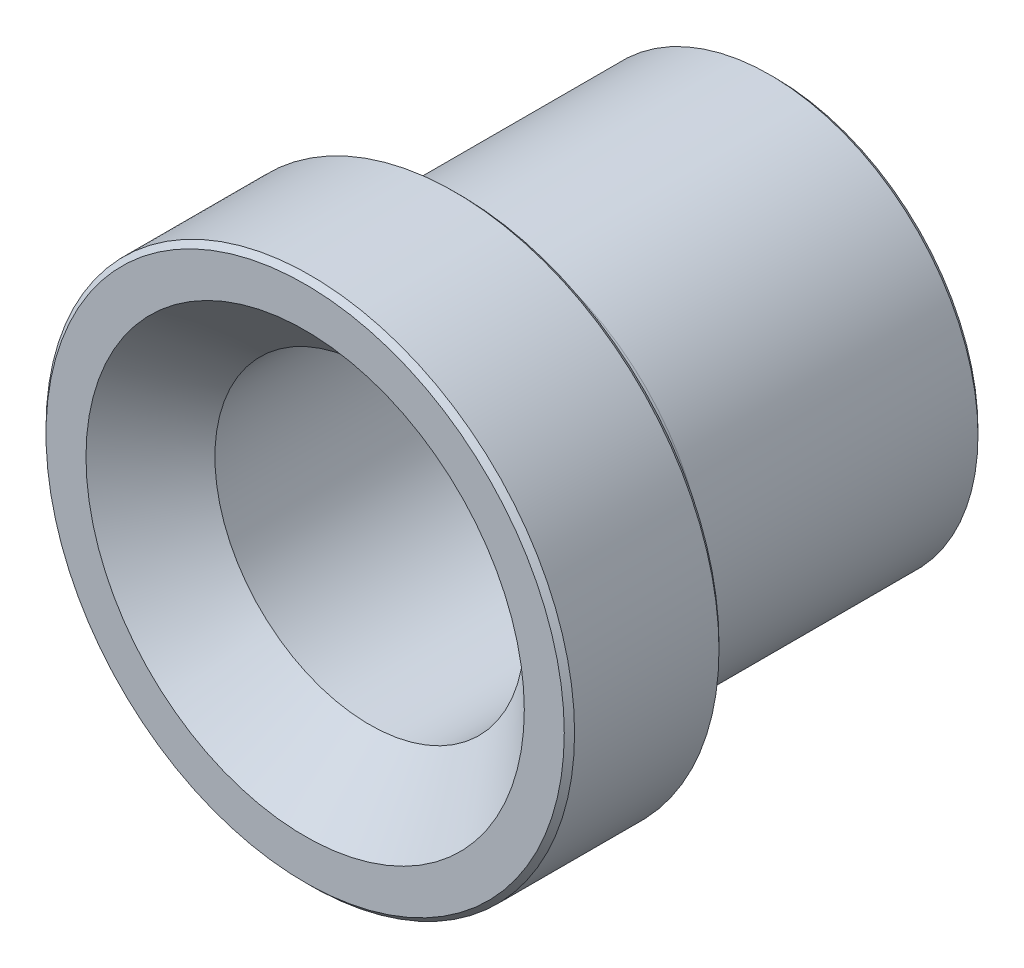
from build123d import *

# Parameters (mm, degrees)
CROQUIS2_W            = 5
CROQUIS2_H            = 5
CORTAR_EXTRUIR1_DEPTH = 24.290725622


with BuildPart() as part:
    # Croquis1 → Revolución1 (revolve)
    with BuildSketch(Plane(origin=(0, 0, 0), x_dir=(0, 0, -1), z_dir=(1, 0, 0)), mode=Mode.PRIVATE) as revoluci_n1_sk:
        with BuildLine():
            Line((0, 8.5), (0, 10.05))
            Line((0, 10.05), (0.2, 10.25))
            Line((0.2, 10.25), (5.8, 10.25))
            Line((5.8, 10.25), (6, 10.05))
            Line((6, 10.05), (6, 9.565))
            ThreePointArc((6, 9.565), (6.439339828, 8.504339828), (7.5, 8.065))
            Line((7.5, 8.065), (18.03, 8.065))
            Line((18.03, 8.065), (18.23, 7.865))
            Line((18.23, 7.865), (18.23, 6.2))
            Line((18.23, 6.2), (18.03, 6))
            Line((18.03, 6), (2.5, 6))
            Line((2.5, 6), (0, 8.5))
        make_face()
    revolve(revoluci_n1_sk.sketch.rotate(Axis((0, 0, 0), (0, 0, -1)), 90), axis=Axis((0, 0, 0), (0, 0, -1)))

    # Croquis2 → Cortar-Extruir1 (cut, through all)
    with BuildSketch(Plane(origin=(0, 0, 0), x_dir=(1, 0, 0), z_dir=(0, 1, 0))):
        with Locations((0, 15.73)):
            Rectangle(CROQUIS2_W, CROQUIS2_H)
    extrude(amount=-CORTAR_EXTRUIR1_DEPTH, mode=Mode.SUBTRACT)


solid = part.part
